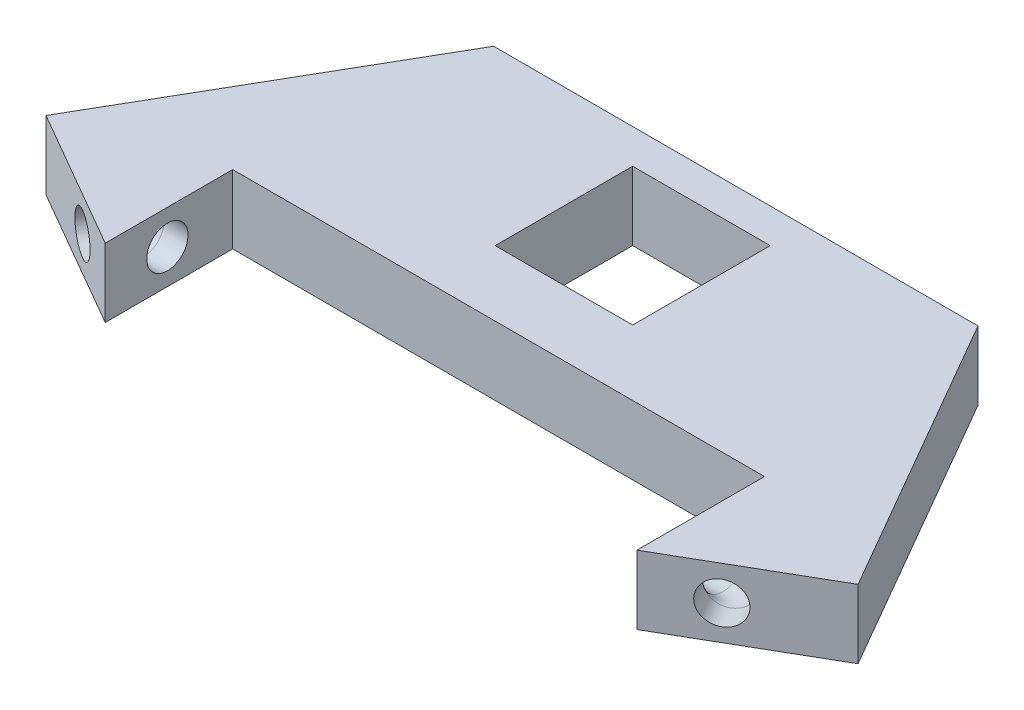
from build123d import *

# Parameters (mm, degrees)
SKETCH1_W           = 20
SKETCH1_H           = 20
BOSS_EXTRUDE1_DEPTH = 10
SKETCH2_R           = 3


with BuildPart() as part:
    # Sketch1 → Boss-Extrude1 (new body)
    with BuildSketch(Plane(origin=(0, 0, 0), x_dir=(1, 0, 0), z_dir=(0, 1, 0))):
        Polygon((-59.044427996, 78.732050808), (-54.714300977, 76.232050808), (-38.661742094, 66.964101615), (-38.661742094, 85.5), (38.661742094, 85.5), (38.661742094, 66.964101615), (54.714300977, 76.232050808), (59.044427996, 78.732050808), (35.218366421, 120), (-35.218366421, 120), align=None)
        with Locations((0, 105)):
            Rectangle(SKETCH1_W, SKETCH1_H, mode=Mode.SUBTRACT)
    extrude(amount=BOSS_EXTRUDE1_DEPTH)

    # Cut-Sweep1: sweep along a path in Sketch3
    with BuildLine(Plane(origin=(0, 5, 0), x_dir=(1, 0, 0), z_dir=(0, 1, 0))) as cut_sweep1_path:
        Line((-38.661742094, 76), (-42.146569651, 76))
        ThreePointArc((-42.146569651, 76), (-43.646569651, 75.598076211), (-44.744645862, 74.5))
        Line((-44.744645862, 74.5), (-46.487059641, 71.482050808))
    # Sketch2 → Cut-Sweep1 (sweep, cut)
    with BuildSketch(Plane(origin=(-38.661742094, 0, 0), x_dir=(0, 0, -1), z_dir=(1, 0, 0))):
        with Locations((76, 5)):
            Circle(SKETCH2_R)
    cut_sweep1 = sweep(path=cut_sweep1_path.line, mode=Mode.SUBTRACT)

    # Mirror3: Cut-Sweep1 across plane
    add(cut_sweep1.mirror(Plane(origin=(0, 0, 0), x_dir=(0, 0, 1), z_dir=(1, 0, 0))), mode=Mode.SUBTRACT)


solid = part.part
